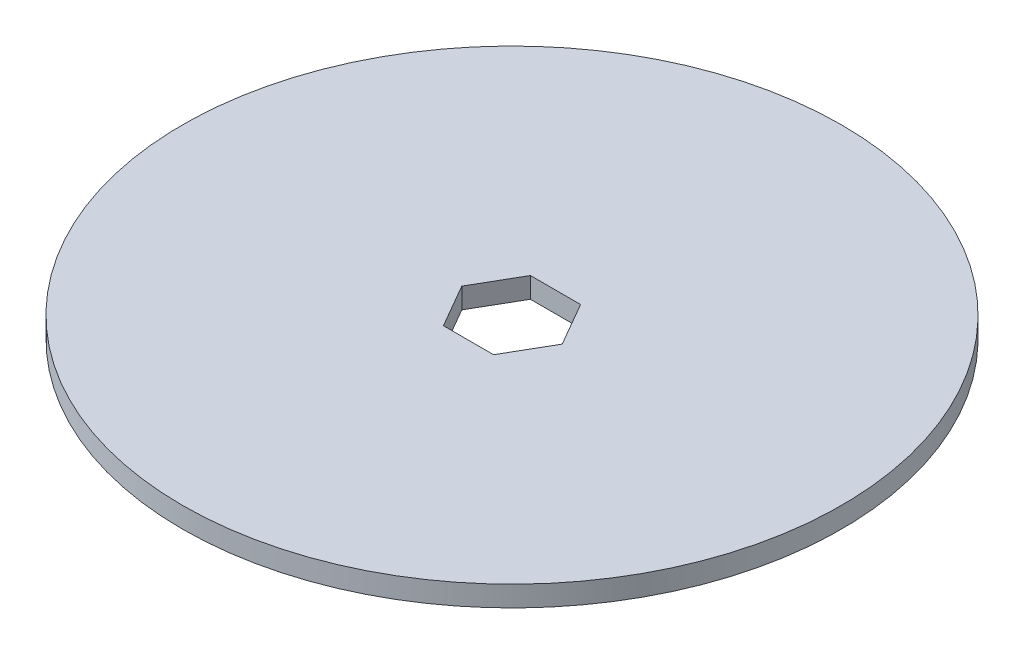
from build123d import *

# Parameters (mm, degrees)
SKETCH2_R           = 25.4
BOSS_EXTRUDE2_DEPTH = 1.5875


with BuildPart() as part:
    # Sketch2 → Boss-Extrude2 (new body)
    with BuildSketch(Plane(origin=(0, 0, 0), x_dir=(1, 0, 0), z_dir=(0, 1, 0))):
        with Locations(Location((0, 0, 0), (0, 0, 270))):
            Circle(SKETCH2_R)
        Polygon((3.87, 0), (1.935, 3.351518313), (-1.935, 3.351518313), (-3.87, 0), (-1.935, -3.351518313), (1.935, -3.351518313), align=None, mode=Mode.SUBTRACT)
    extrude(amount=BOSS_EXTRUDE2_DEPTH)


solid = part.part
